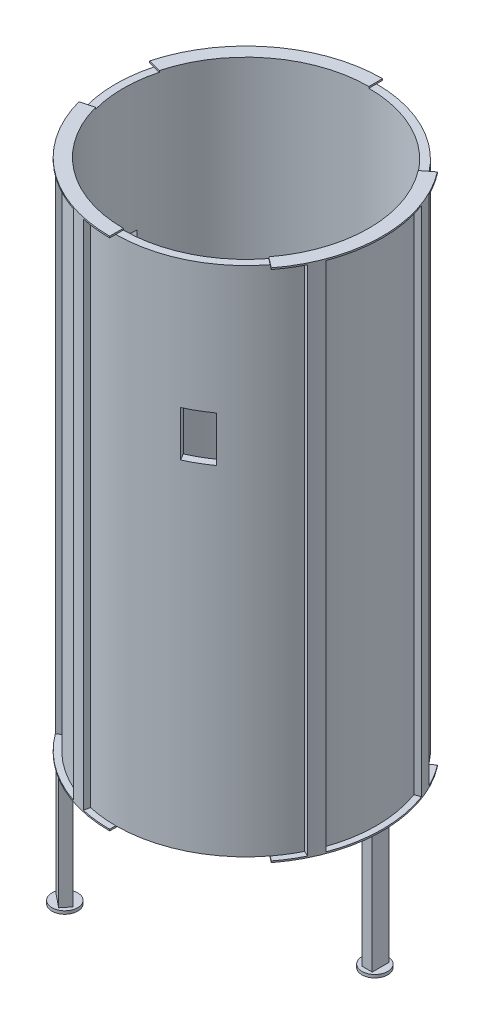
from build123d import *
from build123d.topology import SkipClean

# Parameters (mm, degrees)
IZIM1_R                       = 860
IZIM1_R_2                     = 858.5
Y_KSEKLIK_EKSTR_ZYON1_DEPTH   = 1689
IZIM2_R                       = 858.5
IZIM2_R_2                     = 810
Y_KSEKLIK_EKSTR_ZYON2_DEPTH   = 1689
IZIM3_W                       = 90.627186628
IZIM3_H                       = 174.356131312
KES_EKSTR_ZYON3_DEPTH         = 150
Y_KSEKLIK_EKSTR_ZYON3_DEPTH   = 10
Y_KSEKLIK_EKSTR_ZYON4_DEPTH   = 10
Y_KSEKLIK_EKSTR_ZYON4_2_DEPTH = 10
Y_KSEKLIK_EKSTR_ZYON6_DEPTH   = 10
Y_KSEKLIK_EKSTR_ZYON7_DEPTH   = 10
Y_KSEKLIK_EKSTR_ZYON7_2_DEPTH = 10
Y_KSEKLIK_EKSTR_ZYON7_3_DEPTH = 10
Y_KSEKLIK_EKSTR_ZYON8_DEPTH   = 3378
IZIM9_W                       = 68
IZIM9_H                       = 110
Y_KSEKLIK_EKSTR_ZYON9_DEPTH   = 805
IZIM10_R                      = 85
Y_KSEKLIK_EKSTR_ZYON10_DEPTH  = 20


with BuildPart() as part:
    # Çizim1 → Yükseklik-Ekstrüzyon1 (new, symmetric)
    with BuildSketch(Plane(origin=(0, 0, 0), x_dir=(1, 0, 0), z_dir=(0, 1, 0))):
        with Locations(Location((0, 0, 0), (0, 0, 270))):
            Circle(IZIM1_R)
        with Locations(Location((0, 0, 0), (0, 0, 270))):
            Circle(IZIM1_R_2, mode=Mode.SUBTRACT)
    extrude(amount=Y_KSEKLIK_EKSTR_ZYON1_DEPTH, both=True)


with BuildPart() as body_2:
    # Çizim2 → Yükseklik-Ekstrüzyon2 (new, symmetric)
    with BuildSketch(Plane(origin=(0, 0, 0), x_dir=(1, 0, 0), z_dir=(0, 1, 0))):
        with Locations(Location((0, 0, 0), (0, 0, 270))):
            Circle(IZIM2_R)
        with Locations(Location((0, 0, 0), (0, 0, 270))):
            Circle(IZIM2_R_2, mode=Mode.SUBTRACT)
    extrude(amount=Y_KSEKLIK_EKSTR_ZYON2_DEPTH, both=True)


with BuildPart() as kes_ekstr_zyon3_tool:
    # Çizim3 → Kes-Ekstrüzyon3 (new, symmetric)
    with BuildSketch(Plane(origin=(0, 689, 0), x_dir=(1, 0, 0), z_dir=(0, 1, 0))):
        Polygon((370.851260958, 816.689357342), (521.848099979, 729.511291685), (476.534506666, 651.025845793), (325.537667644, 738.203911449), align=None)
        with Locations((-847.385767623, 0)):
            Rectangle(IZIM3_W, IZIM3_H)
        Polygon((521.848099979, -729.511291686), (370.851260958, -816.689357342), (325.537667644, -738.203911449), (476.534506666, -651.025845793), align=None)
    extrude(amount=KES_EKSTR_ZYON3_DEPTH, both=True)


with BuildPart() as part_1:
    add(part.part)

    # Kes-Ekstrüzyon3: cut by kes_ekstr_zyon3_tool
    add(kes_ekstr_zyon3_tool.part, mode=Mode.SUBTRACT)



with BuildPart() as body_2_1:
    add(body_2.part)

    # Kes-Ekstrüzyon3: cut by kes_ekstr_zyon3_tool
    add(kes_ekstr_zyon3_tool.part, mode=Mode.SUBTRACT)


with BuildPart() as body_3:
    # Çizim4 → Yükseklik-Ekstrüzyon3 (new body)
    with BuildSketch(Plane(origin=(0, 1689, 0), x_dir=(1, 0, 0), z_dir=(0, 1, 0))):
        with BuildLine():
            Line((-782.399919294, 209.643426533), (-829.247321869, 222.196150221))
            ThreePointArc((-829.247321869, 222.196150221), (-522.621686804, 681.09384264), (0, 858.5))
            Line((0, 858.5), (0, 810))
            ThreePointArc((0, 810), (-493.096757497, 642.616205636), (-782.399919294, 209.643426533))
        make_face()
    extrude(amount=Y_KSEKLIK_EKSTR_ZYON3_DEPTH)



with BuildPart() as body_4:
    # Çizim4<3> → Yükseklik-Ekstrüzyon4 (new body)
    with BuildSketch(Plane(origin=(0, 1689, 0), x_dir=(1, 0, 0), z_dir=(0, 1, 0))):
        with BuildLine():
            ThreePointArc((810, 0), (767.013404891, -260.365966896), (642.616205636, -493.096757497))
            Line((642.616205636, -493.096757497), (681.09384264, -522.621686804))
            ThreePointArc((681.09384264, -522.621686804), (812.939516172, -275.955780963), (858.5, 0))
            ThreePointArc((858.5, 0), (812.939516172, 275.955780963), (681.09384264, 522.621686804))
            Line((681.09384264, 522.621686804), (642.616205636, 493.096757497))
            ThreePointArc((642.616205636, 493.096757497), (767.013404891, 260.365966896), (810, 0))
        make_face()
    extrude(amount=Y_KSEKLIK_EKSTR_ZYON4_DEPTH)


with BuildPart() as body_5:
    # Çizim4<3> → Y_kseklik-Ekstr_zyon4 2 (new body)
    with BuildSketch(Plane(origin=(0, 1689, 0), x_dir=(1, 0, 0), z_dir=(0, 1, 0))):
        with BuildLine():
            Line((0, -858.5), (0, -810))
            ThreePointArc((0, -810), (-493.096757497, -642.616205636), (-782.399919294, -209.643426533))
            Line((-782.399919294, -209.643426533), (-829.247321869, -222.196150221))
            ThreePointArc((-829.247321869, -222.196150221), (-522.621686804, -681.09384264), (0, -858.5))
        make_face()
    extrude(amount=Y_KSEKLIK_EKSTR_ZYON4_2_DEPTH)


with BuildPart() as body_3_1:
    add(body_3.part)

    add(body_5.part)  # Yükseklik-Ekstrüzyon6 merges body 5

    add(body_4.part)  # Yükseklik-Ekstrüzyon6 merges body 4
    # Çizim6 → Yükseklik-Ekstrüzyon6 (add)
    with BuildSketch(Plane(origin=(0, 1699, 0), x_dir=(1, 0, 0), z_dir=(0, 1, 0))):
        with BuildLine():
            Line((-782.399919294, -209.643426533), (-869.33324366, -232.937140592))
            ThreePointArc((-869.33324366, -232.937140592), (-547.885286108, -714.018006262), (0, -900))
            Line((0, -900), (0, -810))
            ThreePointArc((0, -810), (-493.096757497, -642.616205636), (-782.399919294, -209.643426533))
        make_face()
        with BuildLine():
            Line((642.616205636, -493.096757497), (714.018006262, -547.885286108))
            ThreePointArc((714.018006262, -547.885286108), (900, 0), (714.018006262, 547.885286108))
            Line((714.018006262, 547.885286108), (642.616205636, 493.096757497))
            ThreePointArc((642.616205636, 493.096757497), (810, 0), (642.616205636, -493.096757497))
        make_face()
        with BuildLine():
            Line((-782.399919294, 209.643426533), (-869.33324366, 232.937140592))
            ThreePointArc((-869.33324366, 232.937140592), (-547.885286108, 714.018006262), (0, 900))
            Line((0, 900), (0, 810))
            ThreePointArc((0, 810), (-493.096757497, 642.616205636), (-782.399919294, 209.643426533))
        make_face()
    extrude(amount=-Y_KSEKLIK_EKSTR_ZYON6_DEPTH)


with BuildPart() as body_4_2:
    # Çizim7 → Yükseklik-Ekstrüzyon7 (new body)
    with BuildSketch(Plane.XZ.offset(1689)):
        with BuildLine():
            Line((-869.33324366, -232.937140592), (-782.399919294, -209.643426533))
            ThreePointArc((-782.399919294, -209.643426533), (-493.096757497, -642.616205636), (0, -810))
            Line((0, -810), (0, -900))
            ThreePointArc((0, -900), (-547.885286108, -714.018006262), (-869.33324366, -232.937140592))
        make_face()
    extrude(amount=Y_KSEKLIK_EKSTR_ZYON7_DEPTH)


with BuildPart() as body_5_2:
    # Çizim7 → Y_kseklik-Ekstr_zyon7 2 (new body)
    with BuildSketch(Plane.XZ.offset(1689)):
        with BuildLine():
            Line((-869.33324366, 232.937140592), (-782.399919294, 209.643426533))
            ThreePointArc((-782.399919294, 209.643426533), (-493.096757497, 642.616205636), (0, 810))
            Line((0, 810), (0, 900))
            ThreePointArc((0, 900), (-547.885286108, 714.018006262), (-869.33324366, 232.937140592))
        make_face()
    extrude(amount=Y_KSEKLIK_EKSTR_ZYON7_2_DEPTH)


with BuildPart() as body_6:
    # Çizim7 → Y_kseklik-Ekstr_zyon7 3 (new body)
    with BuildSketch(Plane.XZ.offset(1689)):
        with BuildLine():
            Line((714.018006262, -547.885286108), (642.616205636, -493.096757497))
            ThreePointArc((642.616205636, -493.096757497), (810, 0), (642.616205636, 493.096757497))
            Line((642.616205636, 493.096757497), (714.018006262, 547.885286108))
            ThreePointArc((714.018006262, 547.885286108), (900, 0), (714.018006262, -547.885286108))
        make_face()
    extrude(amount=Y_KSEKLIK_EKSTR_ZYON7_3_DEPTH)


with BuildPart() as part_2:
    with SkipClean():  # the faces are left unmerged after this step: merging them gives an invalid solid
        add(part_1.part)

        add(body_2_1.part)  # Yükseklik-Ekstrüzyon8 merges body 2

        add(body_3_1.part)  # Yükseklik-Ekstrüzyon8 merges body 3

        add(body_4_2.part)  # Yükseklik-Ekstrüzyon8 merges body 4 2

        add(body_5_2.part)  # Yükseklik-Ekstrüzyon8 merges body 5 2

        add(body_6.part)  # Yükseklik-Ekstrüzyon8 merges body 6
        # Çizim8 → Yükseklik-Ekstrüzyon8 (add)
        with BuildSketch(Plane(origin=(0, -1689, 0), x_dir=(1, 0, 0), z_dir=(0, 1, 0))):
            with BuildLine():
                Line((-740.133265027, 435), (-775.911401892, 456.027955737))
                ThreePointArc((-775.911401892, 456.027955737), (-750.981383146, 496.01105045), (-723.992976628, 534.634613352))
                Line((-723.992976628, 534.634613352), (-690.608856039, 509.982017292))
                ThreePointArc((-690.608856039, 509.982017292), (-716.352797145, 473.139429791), (-740.133265027, 435))
            make_face()
            with BuildLine():
                Line((-273.199988147, 813.869778574), (-286.406510579, 853.212347952))
                ThreePointArc((-286.406510579, 853.212347952), (-241.360316302, 867.032408688), (-195.652570174, 878.475993858))
                Line((-195.652570174, 878.475993858), (-186.630812772, 837.968489696))
                ThreePointArc((-186.630812772, 837.968489696), (-230.230923939, 827.052580954), (-273.199988147, 813.869778574))
            make_face()
            with BuildLine():
                Line((-273.199988147, -813.869778574), (-286.406510579, -853.212347952))
                ThreePointArc((-286.406510579, -853.212347952), (-241.360316302, -867.032408688), (-195.652570174, -878.475993858))
                Line((-195.652570174, -878.475993858), (-186.630812772, -837.968489696))
                ThreePointArc((-186.630812772, -837.968489696), (-230.230923939, -827.052580954), (-273.199988147, -813.869778574))
            make_face()
            with BuildLine():
                Line((-740.133265027, -435), (-775.911401892, -456.027955737))
                ThreePointArc((-775.911401892, -456.027955737), (-750.981383146, -496.01105045), (-723.992976628, -534.634613352))
                Line((-723.992976628, -534.634613352), (-690.608856039, -509.982017292))
                ThreePointArc((-690.608856039, -509.982017292), (-716.352797145, -473.139429791), (-740.133265027, -435))
            make_face()
            with BuildLine():
                Line((805.76673212, -400.923899772), (768.611932806, -382.436853283))
                ThreePointArc((768.611932806, -382.436853283), (787.573775284, -341.686696384), (804.376932787, -300))
                Line((804.376932787, -300), (843.260616783, -314.502038439))
                ThreePointArc((843.260616783, -314.502038439), (825.645192493, -358.203875067), (805.76673212, -400.923899772))
            make_face()
            with BuildLine():
                Line((805.76673212, 400.923899772), (768.611932806, 382.436853283))
                ThreePointArc((768.611932806, 382.436853283), (787.573775284, 341.686696384), (804.376932787, 300))
                Line((804.376932787, 300), (843.260616783, 314.502038439))
                ThreePointArc((843.260616783, 314.502038439), (825.645192493, 358.203875067), (805.76673212, 400.923899772))
            make_face()
        extrude(amount=Y_KSEKLIK_EKSTR_ZYON8_DEPTH)

    # Çizim9 → Yükseklik-Ekstrüzyon9 (add)
    with SkipClean():  # the faces are left unmerged after this step: merging them gives an invalid solid
        with BuildSketch(Plane.XZ.offset(1699)):
            Polygon((-514.179912363, -721.86311871), (-600, -653.052417812), (-557.462475809, -600), (-471.642388172, -668.810700898), align=None)
            Polygon((-557.462475809, 600), (-471.642388172, 668.810700898), (-514.179912363, 721.86311871), (-600, 653.052417812), align=None)
            with Locations((853, 0)):
                Rectangle(IZIM9_W, IZIM9_H)
        extrude(amount=Y_KSEKLIK_EKSTR_ZYON9_DEPTH)

    # Çizim10 → Yükseklik-Ekstrüzyon10 (add)
    with SkipClean():  # the faces are left unmerged after this step: merging them gives an invalid solid
        with BuildSketch(Plane.XZ.offset(2504)):
            with Locations(Location((849.415102064, 0, 0), (0, 0, 270))):
                Circle(IZIM10_R)
            with Locations(Location((-537.005415531, -660.36532662, 0), (0, 0, 270))):
                Circle(IZIM10_R)
            with Locations(Location((-537.005415531, 658.640095908, 0), (0, 0, 270))):
                Circle(IZIM10_R)
        extrude(amount=-Y_KSEKLIK_EKSTR_ZYON10_DEPTH)


solid = part_2.part
